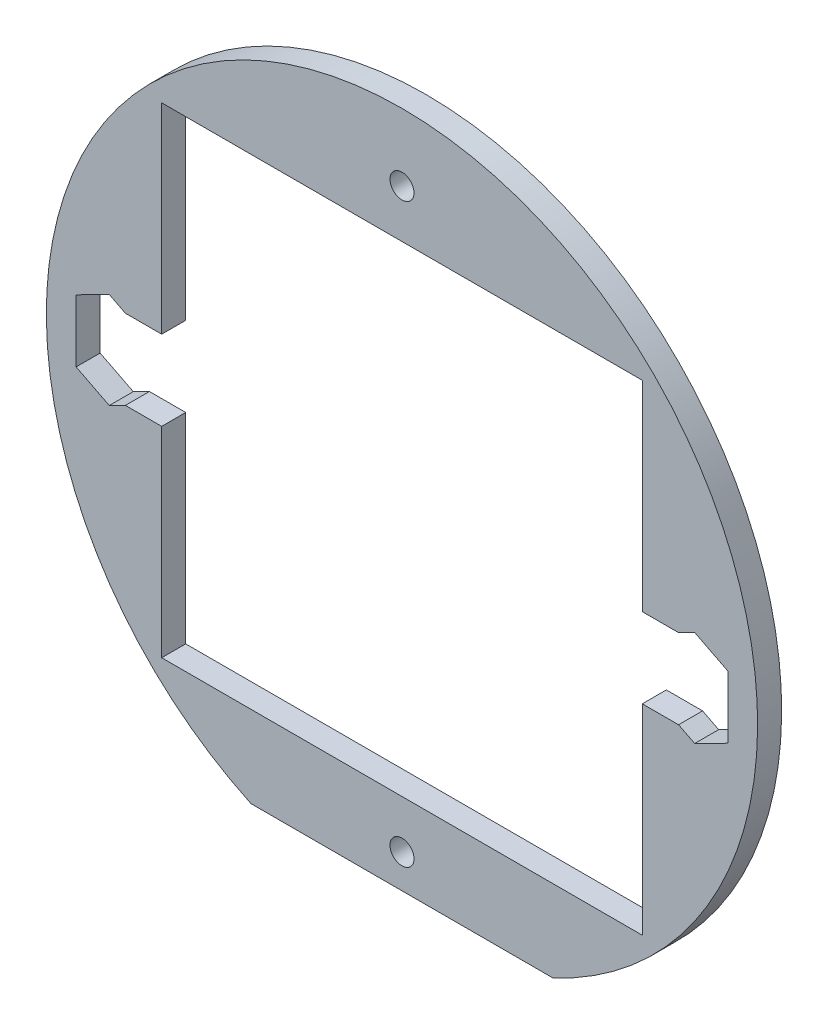
from build123d import *

# Parameters (mm, degrees)
CIRCLE_DEPTH       = 5
SKETCH2_W          = 100
SKETCH2_H          = 100
SQUARE_DEPTH       = 5
SKETCH3_R          = 2.5
HOLES_DEPTH        = 5
CUT_EXTRUDE3_DEPTH = 5


with BuildPart() as part:
    # Sketch1 → circle (new body)
    with BuildSketch(Plane.XY):
        with BuildLine():
            Line((-31.416556145, -67), (31.416556145, -67))
            ThreePointArc((31.416556145, -67), (0, 74), (-31.416556145, -67))
        make_face()
    extrude(amount=CIRCLE_DEPTH)

    # Sketch2 → square (cut)
    with BuildSketch(Plane.XY.offset(5)):
        Rectangle(SKETCH2_W, SKETCH2_H)
    extrude(amount=-SQUARE_DEPTH, mode=Mode.SUBTRACT)

    # Sketch3 → holes (cut)
    with BuildSketch(Plane.XY.offset(5)):
        with Locations((0, 60)):
            Circle(SKETCH3_R)
        with Locations((0, -60)):
            Circle(SKETCH3_R)
    extrude(amount=-HOLES_DEPTH, mode=Mode.SUBTRACT)

    # Sketch4 → Cut-Extrude3 (cut)
    with BuildSketch(Plane.XY.offset(5)):
        Polygon((-50, 0), (-50, -8.3), (-57.55, -8.3), (-60.903744176, -10), (-67.80719259, -6.5), (-67.80719259, 6.5), (-60.903744176, 10), (-57.55, 8.3), (-50, 8.3), align=None)
        Polygon((57.55, 8.3), (50, 8.3), (50, 0), (50, -8.3), (57.55, -8.3), (60.903744176, -10), (67.80719259, -6.5), (67.80719259, 6.5), (60.903744176, 10), align=None)
    extrude(amount=-CUT_EXTRUDE3_DEPTH, mode=Mode.SUBTRACT)


solid = part.part
